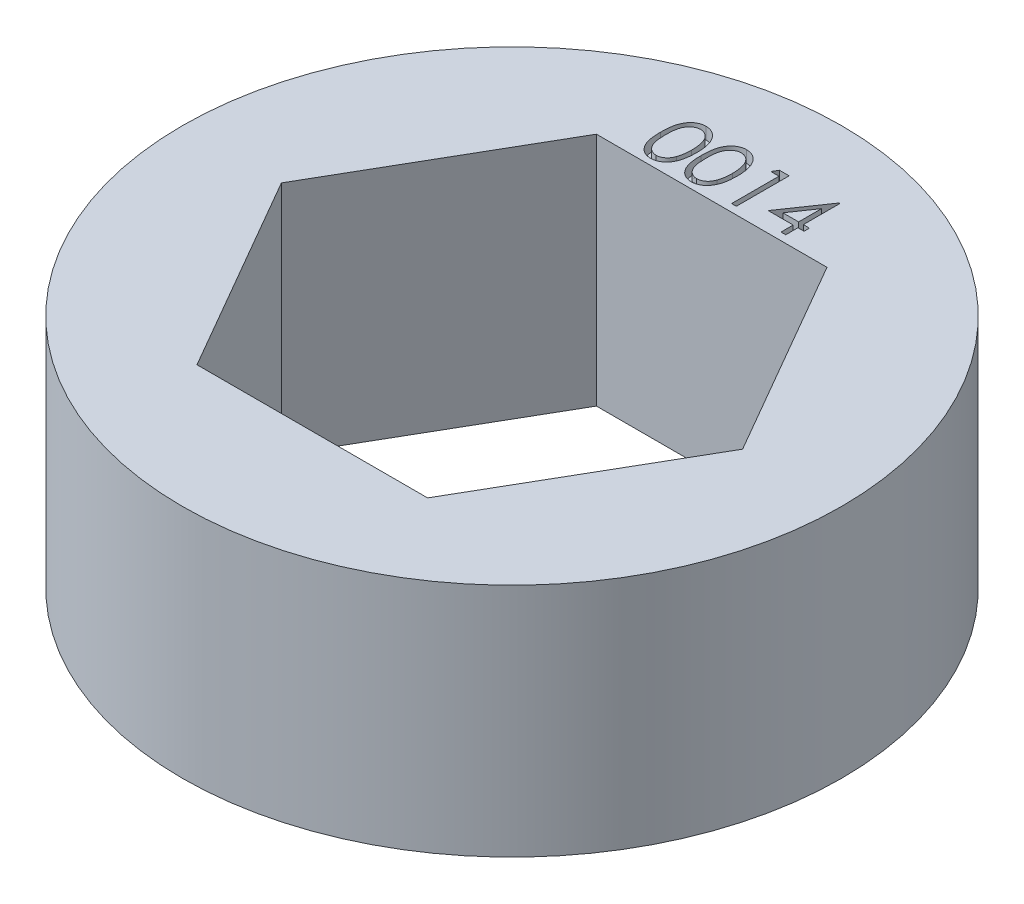
from build123d import *

# Parameters (mm, degrees)
SKETCH1_R           = 11.1125
BOSS_EXTRUDE1_DEPTH = 7.9375
CUT_EXTRUDE1_DEPTH  = 0.4


with BuildPart() as part:
    # Sketch1 → Boss-Extrude1 (new body)
    with BuildSketch(Plane(origin=(0, 0, 0), x_dir=(1, 0, 0), z_dir=(0, 1, 0))):
        with Locations(Location((0, 0, 0), (0, 0, 270))):
            Circle(SKETCH1_R)
        Polygon((7.772289324, 0), (3.886144662, 6.731), (-3.886144662, 6.731), (-7.772289324, 0), (-3.886144662, -6.731), (3.886144662, -6.731), align=None, mode=Mode.SUBTRACT)
    extrude(amount=BOSS_EXTRUDE1_DEPTH)

    # Sketch2 → Cut-Extrude1 (cut)
    # profile 1 of 4: a face of its own
    with BuildSketch(Plane(origin=(0, 7.9375, 0), x_dir=(1, 0, 0), z_dir=(0, 1, 0))):
        with BuildLine():
            add(Edge.make_bspline(
                [(-2.864554752, 7.87328766), (-2.864388119, 7.901785133), (-2.864064431, 7.957141885), (-2.860463514, 8.037804483), (-2.85448164, 8.11347631), (-2.846283854, 8.184160988), (-2.83630776, 8.249876764), (-2.822990293, 8.310448021), (-2.807845389, 8.366155101), (-2.790292747, 8.417179662), (-2.77048695, 8.464209135), (-2.748930346, 8.508113137), (-2.72476743, 8.548825239), (-2.699379158, 8.586995236), (-2.671737826, 8.621998313), (-2.64263004, 8.654328786), (-2.610919727, 8.683239447), (-2.577684839, 8.709577368), (-2.542624475, 8.7326657), (-2.506738001, 8.753002331), (-2.469778407, 8.770375864), (-2.431644786, 8.784036205), (-2.392679887, 8.795319315), (-2.352747497, 8.803035301), (-2.311781684, 8.80789021), (-2.284130515, 8.808354354), (-2.270107236, 8.808589744)],
                knots=[0, 0, 0, 0, 1.646270934, 3.197905019, 4.663502075, 6.030701355, 7.308322542, 8.50163776, 9.611534131, 10.641858119, 11.616356847, 12.558055219, 13.465016945, 14.349605745, 15.204443733, 16.039544428, 16.859896111, 17.680448484, 18.487036065, 19.28249412, 20.06191084, 20.843045899, 21.620316918, 22.403196591, 23.190181807, 24, 24, 24, 24], degree=3))
            add(Edge.make_bspline(
                [(-2.270107236, 8.808589744), (-2.255966813, 8.808341933), (-2.22784596, 8.807849117), (-2.18627105, 8.803112554), (-2.145656612, 8.795253224), (-2.106175797, 8.784117369), (-2.067504304, 8.770301965), (-2.029944609, 8.752985709), (-1.993263411, 8.732828845), (-1.958043625, 8.709143915), (-1.923898601, 8.682736919), (-1.891667036, 8.652885483), (-1.861345996, 8.619891026), (-1.832554941, 8.584106559), (-1.806110697, 8.544845736), (-1.780927394, 8.502791408), (-1.7583864, 8.457208129), (-1.736677185, 8.408856451), (-1.717938595, 8.356398512), (-1.701039343, 8.300130014), (-1.687384827, 8.239386327), (-1.676011076, 8.174486154), (-1.667199869, 8.105191153), (-1.660782487, 8.031649865), (-1.65739256, 7.953813906), (-1.656754156, 7.900596919), (-1.656426547, 7.87328766)],
                knots=[0, 0, 0, 0, 0.810914788, 1.612654377, 2.396697861, 3.181598691, 3.963628158, 4.749916497, 5.551656086, 6.361998678, 7.18212741, 8.025565596, 8.878627764, 9.750805457, 10.657531673, 11.591944965, 12.560506719, 13.57287815, 14.630710178, 15.753379473, 16.941251878, 18.199788006, 19.531962791, 20.947069417, 22.433333509, 24, 24, 24, 24], degree=3))
            add(Edge.make_bspline(
                [(-1.656426547, 7.87328766), (-1.656757552, 7.846097515), (-1.657402502, 7.793118626), (-1.660744485, 7.71563289), (-1.667327469, 7.642481884), (-1.675562143, 7.573490169), (-1.686967232, 7.508944899), (-1.700990657, 7.448622719), (-1.716561021, 7.392263131), (-1.735781096, 7.340327847), (-1.756817737, 7.292092371), (-1.779705777, 7.24704946), (-1.804226849, 7.204800983), (-1.830941931, 7.165685112), (-1.859417065, 7.129424754), (-1.890261702, 7.096659962), (-1.922606359, 7.06660126), (-1.956851866, 7.039854234), (-1.992620934, 7.016443153), (-2.029176145, 6.995506517), (-2.067166104, 6.978624308), (-2.105729884, 6.964128507), (-2.145419094, 6.953053877), (-2.18618426, 6.945396359), (-2.227818028, 6.94002586), (-2.255962023, 6.939616168), (-2.270107236, 6.939410256)],
                knots=[0, 0, 0, 0, 1.561518951, 3.042555995, 4.452378317, 5.7783523, 7.031515105, 8.214008947, 9.334062868, 10.386615937, 11.391082383, 12.354592575, 13.286541444, 14.194233754, 15.072674879, 15.931287219, 16.775624067, 17.606195743, 18.42308326, 19.229000347, 20.022332153, 20.807536673, 21.593273796, 22.3848459, 23.188221202, 24, 24, 24, 24], degree=3))
            add(Edge.make_bspline(
                [(-2.270107236, 6.939410256), (-2.284130126, 6.939647165), (-2.311780528, 6.940114302), (-2.35275196, 6.944947278), (-2.392519441, 6.952717394), (-2.431279208, 6.963597029), (-2.469230118, 6.976914165), (-2.505855031, 6.994264237), (-2.541561175, 7.014245944), (-2.576253285, 7.037002018), (-2.609279463, 7.063073433), (-2.640825555, 7.091909691), (-2.670099064, 7.124230384), (-2.697345185, 7.159525169), (-2.723240022, 7.197469336), (-2.747059823, 7.23858095), (-2.769092217, 7.282696996), (-2.78923111, 7.330102495), (-2.807086631, 7.381489198), (-2.822858867, 7.437444981), (-2.835312059, 7.498463724), (-2.845971401, 7.564055346), (-2.854568987, 7.634501703), (-2.860438584, 7.709841038), (-2.864066372, 7.790026404), (-2.864388988, 7.84502745), (-2.864554752, 7.87328766)],
                knots=[0, 0, 0, 0, 0.810891512, 1.598919785, 2.382837074, 3.152667961, 3.926044502, 4.706494248, 5.493654104, 6.291793342, 7.103789334, 7.925228297, 8.761435821, 9.622817696, 10.50288917, 11.416980706, 12.369136599, 13.353924996, 14.394355917, 15.514179734, 16.714354668, 17.994756427, 19.357759367, 20.818452758, 22.365282078, 24, 24, 24, 24], degree=3))
        make_face()
        with BuildLine():
            add(Edge.make_bspline(
                [(-2.70499065, 7.874), (-2.70492997, 7.850251661), (-2.704812204, 7.804160798), (-2.701735654, 7.737184422), (-2.697544536, 7.674715495), (-2.692138757, 7.616674698), (-2.68411086, 7.563258492), (-2.675115811, 7.514099493), (-2.664169382, 7.469457856), (-2.651217913, 7.429027248), (-2.636466052, 7.392121522), (-2.620359473, 7.357780104), (-2.603056626, 7.325597321), (-2.583692097, 7.295862248), (-2.562602445, 7.268477916), (-2.540264029, 7.242959637), (-2.515843157, 7.220202771), (-2.482059255, 7.192909529), (-2.437458646, 7.164705809), (-2.381263455, 7.140145995), (-2.323519882, 7.124711707), (-2.284327047, 7.122748919), (-2.264764688, 7.121769231)],
                knots=[0, 0, 0, 0, 1.459021318, 2.831673884, 4.118529203, 5.306027144, 6.411944654, 7.436330062, 8.375795394, 9.233974572, 10.042671642, 10.816086306, 11.563610507, 12.285937304, 12.993564865, 13.685989202, 14.367179055, 15.041617293, 16.353048772, 17.594441528, 18.799311195, 20, 20, 20, 20], degree=3))
            add(Edge.make_bspline(
                [(-2.264764688, 7.121769231), (-2.245075791, 7.122580903), (-2.205738647, 7.124202573), (-2.148266679, 7.139848332), (-2.092472901, 7.163454858), (-2.048748356, 7.19136819), (-2.015483224, 7.217950982), (-1.991649393, 7.240615223), (-1.969773872, 7.265992804), (-1.949026098, 7.293373646), (-1.929996888, 7.323280868), (-1.912692814, 7.355570656), (-1.896902473, 7.390332679), (-1.887906278, 7.414599706), (-1.883306755, 7.427006811)],
                knots=[0, 0, 0, 0, 1.353760809, 2.704726607, 4.075137775, 5.516104923, 6.260822281, 7.007110065, 7.778089737, 8.566572457, 9.372053459, 10.217411131, 11.088608312, 12, 12, 12, 12], degree=3))
            add(Edge.make_bspline(
                [(-1.883306755, 7.427006811), (-1.877946457, 7.442871519), (-1.867062753, 7.475083679), (-1.853035972, 7.525052414), (-1.841989309, 7.577479418), (-1.83205112, 7.632051377), (-1.825267767, 7.689170746), (-1.819807878, 7.748660789), (-1.816591889, 7.810566361), (-1.816193235, 7.852626216), (-1.81599065, 7.874)],
                knots=[0, 0, 0, 0, 0.884706709, 1.796334032, 2.740027952, 3.714592787, 4.726048262, 5.777819803, 6.87074269, 8, 8, 8, 8], degree=3))
            add(Edge.make_bspline(
                [(-1.81599065, 7.874), (-1.816270146, 7.895370327), (-1.8168169, 7.937175255), (-1.818906806, 7.99839849), (-1.824303581, 8.056548113), (-1.830297534, 8.111874633), (-1.839135322, 8.164071787), (-1.848664288, 8.213576542), (-1.861466504, 8.259775598), (-1.87514175, 8.303392266), (-1.89079343, 8.343930998), (-1.908022623, 8.381580802), (-1.926423277, 8.416523442), (-1.946409135, 8.448663048), (-1.967742942, 8.47814358), (-1.990987777, 8.504373954), (-2.015221598, 8.528167134), (-2.049164729, 8.555326119), (-2.093601668, 8.58301806), (-2.148895257, 8.608502266), (-2.206436744, 8.623136879), (-2.245336059, 8.625200216), (-2.264764688, 8.626230769)],
                knots=[0, 0, 0, 0, 1.31362396, 2.569729283, 3.763502607, 4.902122613, 5.988968491, 7.01645872, 7.998833611, 8.933434873, 9.825090667, 10.667526885, 11.477055099, 12.250526234, 12.991942729, 13.710640831, 14.402115721, 15.076753259, 16.378508321, 17.609869233, 18.806226677, 20, 20, 20, 20], degree=3))
            add(Edge.make_bspline(
                [(-2.264764688, 8.626230769), (-2.284429669, 8.625198794), (-2.323795455, 8.623132965), (-2.381935016, 8.608556792), (-2.437664827, 8.583150205), (-2.481984258, 8.5552344), (-2.515951062, 8.528646538), (-2.53986907, 8.505590219), (-2.562295325, 8.480369922), (-2.582954517, 8.452733749), (-2.602303873, 8.423033342), (-2.620074227, 8.39103505), (-2.636085031, 8.356576717), (-2.650859975, 8.319687568), (-2.663850951, 8.279260448), (-2.674566685, 8.234673799), (-2.684466108, 8.185671158), (-2.691474104, 8.131965648), (-2.697704092, 8.073910314), (-2.701707817, 8.011285437), (-2.704822496, 7.944196731), (-2.704933476, 7.897867559), (-2.70499065, 7.874)],
                knots=[0, 0, 0, 0, 1.207732386, 2.417664972, 3.655092373, 4.956220595, 5.625982001, 6.301752483, 6.994047911, 7.697131622, 8.419323945, 9.170223765, 9.943494443, 10.752040957, 11.610060368, 12.549350801, 13.567764191, 14.679664412, 15.874934091, 17.154273443, 18.533957287, 20, 20, 20, 20], degree=3))
        make_face(mode=Mode.SUBTRACT)
    # profile 2 of 4: a face of its own
    with BuildSketch(Plane(origin=(0, 7.9375, 0), x_dir=(1, 0, 0), z_dir=(0, 1, 0))):
        with BuildLine():
            add(Edge.make_bspline(
                [(-1.496862444, 7.87328766), (-1.496695811, 7.901785133), (-1.496372124, 7.957141885), (-1.492771206, 8.037804483), (-1.486789332, 8.11347631), (-1.478591547, 8.184160988), (-1.468615453, 8.249876764), (-1.455297985, 8.310448021), (-1.440153082, 8.366155101), (-1.422600439, 8.417179662), (-1.402794642, 8.464209135), (-1.381238038, 8.508113137), (-1.357075122, 8.548825239), (-1.331686851, 8.586995236), (-1.304045518, 8.621998313), (-1.274937733, 8.654328786), (-1.24322742, 8.683239447), (-1.209992531, 8.709577368), (-1.174932167, 8.7326657), (-1.139045693, 8.753002331), (-1.102086099, 8.770375864), (-1.063952478, 8.784036205), (-1.024987579, 8.795319315), (-0.985055189, 8.803035301), (-0.944089376, 8.80789021), (-0.916438207, 8.808354354), (-0.902414928, 8.808589744)],
                knots=[0, 0, 0, 0, 1.646270934, 3.197905019, 4.663502075, 6.030701355, 7.308322542, 8.50163776, 9.611534131, 10.641858119, 11.616356847, 12.558055219, 13.465016945, 14.349605745, 15.204443733, 16.039544428, 16.859896111, 17.680448484, 18.487036065, 19.28249412, 20.06191084, 20.843045899, 21.620316918, 22.403196591, 23.190181807, 24, 24, 24, 24], degree=3))
            add(Edge.make_bspline(
                [(-0.902414928, 8.808589744), (-0.888274505, 8.808341933), (-0.860153653, 8.807849117), (-0.818578742, 8.803112554), (-0.777964304, 8.795253224), (-0.738483489, 8.784117369), (-0.699811996, 8.770301965), (-0.662252301, 8.752985709), (-0.625571104, 8.732828845), (-0.590351318, 8.709143915), (-0.556206293, 8.682736919), (-0.523974728, 8.652885483), (-0.493653688, 8.619891026), (-0.464862633, 8.584106559), (-0.43841839, 8.544845736), (-0.413235086, 8.502791408), (-0.390694092, 8.457208129), (-0.368984877, 8.408856451), (-0.350246288, 8.356398512), (-0.333347035, 8.300130014), (-0.319692519, 8.239386327), (-0.308318769, 8.174486154), (-0.299507562, 8.105191153), (-0.293090179, 8.031649865), (-0.289700252, 7.953813906), (-0.289061848, 7.900596919), (-0.288734239, 7.87328766)],
                knots=[0, 0, 0, 0, 0.810914788, 1.612654377, 2.396697861, 3.181598691, 3.963628158, 4.749916497, 5.551656086, 6.361998678, 7.18212741, 8.025565596, 8.878627764, 9.750805457, 10.657531673, 11.591944965, 12.560506719, 13.57287815, 14.630710178, 15.753379473, 16.941251878, 18.199788006, 19.531962791, 20.947069417, 22.433333509, 24, 24, 24, 24], degree=3))
            add(Edge.make_bspline(
                [(-0.288734239, 7.87328766), (-0.289065244, 7.846097515), (-0.289710194, 7.793118626), (-0.293052177, 7.71563289), (-0.299635162, 7.642481884), (-0.307869836, 7.573490169), (-0.319274925, 7.508944899), (-0.333298349, 7.448622719), (-0.348868713, 7.392263131), (-0.368088789, 7.340327847), (-0.38912543, 7.292092371), (-0.412013469, 7.24704946), (-0.436534541, 7.204800983), (-0.463249623, 7.165685112), (-0.491724757, 7.129424754), (-0.522569394, 7.096659962), (-0.554914051, 7.06660126), (-0.589159558, 7.039854234), (-0.624928626, 7.016443153), (-0.661483837, 6.995506517), (-0.699473796, 6.978624308), (-0.738037576, 6.964128507), (-0.777726786, 6.953053877), (-0.818491953, 6.945396359), (-0.860125721, 6.94002586), (-0.888269716, 6.939616168), (-0.902414928, 6.939410256)],
                knots=[0, 0, 0, 0, 1.561518951, 3.042555995, 4.452378317, 5.7783523, 7.031515105, 8.214008947, 9.334062868, 10.386615937, 11.391082383, 12.354592575, 13.286541444, 14.194233754, 15.072674879, 15.931287219, 16.775624067, 17.606195743, 18.42308326, 19.229000347, 20.022332153, 20.807536673, 21.593273796, 22.3848459, 23.188221202, 24, 24, 24, 24], degree=3))
            add(Edge.make_bspline(
                [(-0.902414928, 6.939410256), (-0.916437818, 6.939647165), (-0.94408822, 6.940114302), (-0.985059652, 6.944947278), (-1.024827133, 6.952717394), (-1.063586901, 6.963597029), (-1.10153781, 6.976914165), (-1.138162724, 6.994264237), (-1.173868867, 7.014245944), (-1.208560978, 7.037002018), (-1.241587155, 7.063073433), (-1.273133247, 7.091909691), (-1.302406757, 7.124230384), (-1.329652877, 7.159525169), (-1.355547714, 7.197469336), (-1.379367516, 7.23858095), (-1.401399909, 7.282696996), (-1.421538803, 7.330102495), (-1.439394324, 7.381489198), (-1.45516656, 7.437444981), (-1.467619752, 7.498463724), (-1.478279093, 7.564055346), (-1.486876679, 7.634501703), (-1.492746277, 7.709841038), (-1.496374065, 7.790026404), (-1.49669668, 7.84502745), (-1.496862444, 7.87328766)],
                knots=[0, 0, 0, 0, 0.810891512, 1.598919785, 2.382837074, 3.152667961, 3.926044502, 4.706494248, 5.493654104, 6.291793342, 7.103789334, 7.925228297, 8.761435821, 9.622817696, 10.50288917, 11.416980706, 12.369136599, 13.353924996, 14.394355917, 15.514179734, 16.714354668, 17.994756427, 19.357759367, 20.818452758, 22.365282078, 24, 24, 24, 24], degree=3))
        make_face()
        with BuildLine():
            add(Edge.make_bspline(
                [(-1.337298342, 7.874), (-1.337237663, 7.850251661), (-1.337119896, 7.804160798), (-1.334043347, 7.737184422), (-1.329852229, 7.674715495), (-1.32444645, 7.616674698), (-1.316418552, 7.563258492), (-1.307423504, 7.514099493), (-1.296477074, 7.469457856), (-1.283525605, 7.429027248), (-1.268773744, 7.392121522), (-1.252667165, 7.357780104), (-1.235364318, 7.325597321), (-1.215999789, 7.295862248), (-1.194910137, 7.268477916), (-1.172571722, 7.242959637), (-1.148150849, 7.220202771), (-1.114366948, 7.192909529), (-1.069766339, 7.164705809), (-1.013571147, 7.140145995), (-0.955827574, 7.124711707), (-0.916634739, 7.122748919), (-0.89707238, 7.121769231)],
                knots=[0, 0, 0, 0, 1.459021318, 2.831673884, 4.118529203, 5.306027144, 6.411944654, 7.436330062, 8.375795394, 9.233974572, 10.042671642, 10.816086306, 11.563610507, 12.285937304, 12.993564865, 13.685989202, 14.367179055, 15.041617293, 16.353048772, 17.594441528, 18.799311195, 20, 20, 20, 20], degree=3))
            add(Edge.make_bspline(
                [(-0.89707238, 7.121769231), (-0.877383483, 7.122580903), (-0.838046339, 7.124202573), (-0.780574371, 7.139848332), (-0.724780594, 7.163454858), (-0.681056048, 7.19136819), (-0.647790916, 7.217950982), (-0.623957085, 7.240615223), (-0.602081564, 7.265992804), (-0.58133379, 7.293373646), (-0.56230458, 7.323280868), (-0.545000506, 7.355570656), (-0.529210165, 7.390332679), (-0.52021397, 7.414599706), (-0.515614448, 7.427006811)],
                knots=[0, 0, 0, 0, 1.353760809, 2.704726607, 4.075137775, 5.516104923, 6.260822281, 7.007110065, 7.778089737, 8.566572457, 9.372053459, 10.217411131, 11.088608312, 12, 12, 12, 12], degree=3))
            add(Edge.make_bspline(
                [(-0.515614448, 7.427006811), (-0.51025415, 7.442871519), (-0.499370446, 7.475083679), (-0.485343664, 7.525052414), (-0.474297002, 7.577479418), (-0.464358812, 7.632051377), (-0.457575459, 7.689170746), (-0.45211557, 7.748660789), (-0.448899581, 7.810566361), (-0.448500928, 7.852626216), (-0.448298342, 7.874)],
                knots=[0, 0, 0, 0, 0.884706709, 1.796334032, 2.740027952, 3.714592787, 4.726048262, 5.777819803, 6.87074269, 8, 8, 8, 8], degree=3))
            add(Edge.make_bspline(
                [(-0.448298342, 7.874), (-0.448577838, 7.895370327), (-0.449124592, 7.937175255), (-0.451214498, 7.99839849), (-0.456611274, 8.056548113), (-0.462605226, 8.111874633), (-0.471443014, 8.164071787), (-0.48097198, 8.213576542), (-0.493774196, 8.259775598), (-0.507449442, 8.303392266), (-0.523101123, 8.343930998), (-0.540330316, 8.381580802), (-0.558730969, 8.416523442), (-0.578716827, 8.448663048), (-0.600050634, 8.47814358), (-0.623295469, 8.504373954), (-0.647529291, 8.528167134), (-0.681472421, 8.555326119), (-0.72590936, 8.58301806), (-0.781202949, 8.608502266), (-0.838744437, 8.623136879), (-0.877643751, 8.625200216), (-0.89707238, 8.626230769)],
                knots=[0, 0, 0, 0, 1.31362396, 2.569729283, 3.763502607, 4.902122613, 5.988968491, 7.01645872, 7.998833611, 8.933434873, 9.825090667, 10.667526885, 11.477055099, 12.250526234, 12.991942729, 13.710640831, 14.402115721, 15.076753259, 16.378508321, 17.609869233, 18.806226677, 20, 20, 20, 20], degree=3))
            add(Edge.make_bspline(
                [(-0.89707238, 8.626230769), (-0.916737361, 8.625198794), (-0.956103148, 8.623132965), (-1.014242709, 8.608556792), (-1.069972519, 8.583150205), (-1.11429195, 8.5552344), (-1.148258754, 8.528646538), (-1.172176762, 8.505590219), (-1.194603018, 8.480369922), (-1.215262209, 8.452733749), (-1.234611565, 8.423033342), (-1.252381919, 8.39103505), (-1.268392723, 8.356576717), (-1.283167667, 8.319687568), (-1.296158644, 8.279260448), (-1.306874377, 8.234673799), (-1.3167738, 8.185671158), (-1.323781797, 8.131965648), (-1.330011784, 8.073910314), (-1.334015509, 8.011285437), (-1.337130188, 7.944196731), (-1.337241168, 7.897867559), (-1.337298342, 7.874)],
                knots=[0, 0, 0, 0, 1.207732386, 2.417664972, 3.655092373, 4.956220595, 5.625982001, 6.301752483, 6.994047911, 7.697131622, 8.419323945, 9.170223765, 9.943494443, 10.752040957, 11.610060368, 12.549350801, 13.567764191, 14.679664412, 15.874934091, 17.154273443, 18.533957287, 20, 20, 20, 20], degree=3))
        make_face(mode=Mode.SUBTRACT)
    # profile 3 of 4: a face of its own
    with BuildSketch(Plane(origin=(0, 7.9375, 0), x_dir=(1, 0, 0), z_dir=(0, 1, 0))):
        Polygon((0.248726097, 8.763), (0.577470889, 8.763), (0.577470889, 6.985), (0.417906786, 6.985), (0.417906786, 8.580641026), (0.144368325, 8.580641026), align=None)
    # profile 4 of 4: a face of its own
    with BuildSketch(Plane(origin=(0, 7.9375, 0), x_dir=(1, 0, 0), z_dir=(0, 1, 0))):
        Polygon((2.209085072, 8.808589744), (2.24149653, 8.808589744), (2.24149653, 7.577666667), (2.446650376, 7.577666667), (2.446650376, 7.395307692), (2.24149653, 7.395307692), (2.24149653, 6.985), (2.081932427, 6.985), (2.081932427, 7.395307692), (1.238522171, 7.395307692), align=None)
        Polygon((2.081932427, 7.577666667), (2.081932427, 8.349842949), (1.551951658, 7.577666667), align=None, mode=Mode.SUBTRACT)
    extrude(amount=-CUT_EXTRUDE1_DEPTH, mode=Mode.SUBTRACT)


solid = part.part
